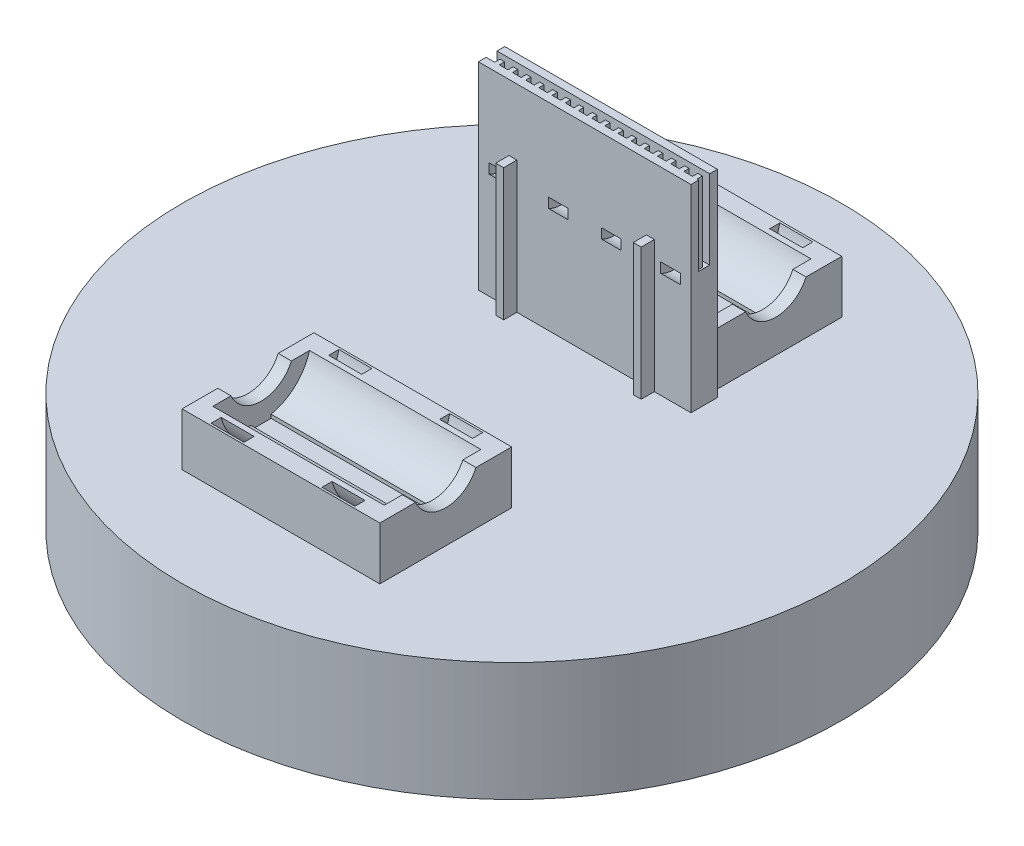
from build123d import *

# Parameters (mm, degrees)
AUFSATZ_LINEAR_AUSTRAGEN1_DEPTH      = 1.6
AUFSATZ_LINEAR_AUSTRAGEN1_DEPTH_BACK = 16.4
SKIZZE1_R                            = 50
SKIZZE2_W                            = 30
SKIZZE2_H                            = 20
AUFSATZ_LINEAR_AUSTRAGEN2_DEPTH      = 8
SKIZZE4_R                            = 7.6
SCHNITT_LINEAR_AUSTRAGEN1_DEPTH      = 85.315834812
AUFSATZ_LINEAR_AUSTRAGEN3_DEPTH      = 2
SKIZZE7_W                            = 3
SKIZZE7_H                            = 0.8
SCHNITT_LINEAR_AUSTRAGEN2_DEPTH      = 13
SKIZZE6_W                            = 5
SKIZZE6_H                            = 1.5
SPIEGELN3_COPY_1_DEPTH               = 2
SPIEGELN3_COPY_2_SKETCH_W            = 5
SPIEGELN3_COPY_2_SKETCH_H            = 1.5
SKIZZE9_W                            = 32.252572888
SKIZZE9_H                            = 4
AUFSATZ_LINEAR_AUSTRAGEN4_DEPTH      = 30
SCHNITT_LINEAR_AUSTRAGEN3_DEPTH      = 12
SKIZZE11_W                           = 1.2
SKIZZE11_H                           = 2
AUFSATZ_LINEAR_AUSTRAGEN5_DEPTH      = 20
SKIZZE13_W                           = 3
SKIZZE13_H                           = 1.2
SCHNITT_ROTATION3_ANGLE              = 180
LINEARES_MUSTER1_COUNT               = 2
LINEARES_MUSTER1_PITCH               = 9
SPIEGELN4_COPY_1_SKETCH_W            = 3
SPIEGELN4_COPY_1_SKETCH_H            = 1.2
SPIEGELN4_COPY_1_ANGLE               = 180


with BuildPart() as part:
    # Skizze1 → Aufsatz-Linear austragen1 (new, two sides: drawn at the far end of the back side and taken through both)
    with BuildSketch(Plane(origin=(0, 10, 0), x_dir=(1, 0, 0), z_dir=(0, 1, 0)).offset(-AUFSATZ_LINEAR_AUSTRAGEN1_DEPTH_BACK)):
        with Locations(Location((0, 0, 0), (0, 0, 270))):
            Circle(SKIZZE1_R)
    extrude(amount=AUFSATZ_LINEAR_AUSTRAGEN1_DEPTH + AUFSATZ_LINEAR_AUSTRAGEN1_DEPTH_BACK)

    # Skizze2 → Aufsatz-Linear austragen2 (add)
    with BuildSketch(Plane(origin=(0, 11.6, 0), x_dir=(1, 0, 0), z_dir=(0, 1, 0))):
        with Locations((0, 25.04)):
            Rectangle(SKIZZE2_W, SKIZZE2_H)
    aufsatz_linear_austragen2 = extrude(amount=AUFSATZ_LINEAR_AUSTRAGEN2_DEPTH)

    # Skizze4 → Schnitt-Linear austragen1 (cut, through all)
    with BuildSketch(Plane.ZY.offset(15)):
        with Locations((-25.04, 21.6)):
            Circle(SKIZZE4_R)
    schnitt_linear_austragen1 = extrude(amount=-SCHNITT_LINEAR_AUSTRAGEN1_DEPTH, mode=Mode.SUBTRACT)

    # Skizze5 → Aufsatz-Linear austragen3 (add)
    with BuildSketch(Plane.ZY.offset(15)):
        with BuildLine():
            Line((-29.622575695, 19.6), (-32.372121112, 19.6))
            ThreePointArc((-32.372121112, 19.6), (-25.04, 14), (-17.707878888, 19.6))
            Line((-17.707878888, 19.6), (-20.457424305, 19.6))
            ThreePointArc((-20.457424305, 19.6), (-25.04, 16.6), (-29.622575695, 19.6))
        make_face()
    aufsatz_linear_austragen3 = extrude(amount=-AUFSATZ_LINEAR_AUSTRAGEN3_DEPTH)

    # Spiegeln1: Aufsatz-Linear austragen3 across plane
    add(aufsatz_linear_austragen3.mirror(Plane(origin=(0, 0, 0), x_dir=(0, 0, 1), z_dir=(1, 0, 0))))

    # Skizze7 → Schnitt-Linear austragen2 (cut, symmetric)
    with BuildSketch(Plane(origin=(0, 0, 0), x_dir=(0, 0, -1), z_dir=(1, 0, 0))):
        with Locations((25.04, 14)):
            Rectangle(SKIZZE7_W, SKIZZE7_H)
    schnitt_linear_austragen2 = extrude(amount=SCHNITT_LINEAR_AUSTRAGEN2_DEPTH, both=True, mode=Mode.SUBTRACT)

    # Skizze6 → Schnitt-Rotation2 (revolve, cut)
    with BuildSketch(Plane.XY.offset(-25.04)):
        with Locations((-8.412172741, 30.75)):
            Rectangle(SKIZZE6_W, SKIZZE6_H)
    schnitt_rotation2 = revolve(axis=Axis((-15, 21.6, -25.04), (1, 0, 0)), mode=Mode.SUBTRACT)

    # Spiegeln2: Schnitt-Rotation2 across plane
    add(schnitt_rotation2.mirror(Plane(origin=(0, 0, 0), x_dir=(0, 0, 1), z_dir=(1, 0, 0))), mode=Mode.SUBTRACT)

    # Spiegeln3: Aufsatz-Linear austragen2, Schnitt-Linear austragen1, Aufsatz-Linear austragen3, Schnitt-Linear austragen2, Schnitt-Rotation2 across plane
    add(aufsatz_linear_austragen2.mirror(Plane.XY))
    add(schnitt_linear_austragen1.mirror(Plane.XY), mode=Mode.SUBTRACT)
    add(aufsatz_linear_austragen3.mirror(Plane.XY))
    add(schnitt_linear_austragen2.mirror(Plane.XY), mode=Mode.SUBTRACT)
    add(schnitt_rotation2.mirror(Plane.XY), mode=Mode.SUBTRACT)

    # Spiegeln3 copy 1 sketch → Spiegeln3 copy 1 (add)
    with BuildSketch(Plane(origin=(15, 0, 0), x_dir=(0, 0, -1), z_dir=(1, 0, 0))):
        with BuildLine():
            Line((-29.622575695, 19.6), (-32.372121112, 19.6))
            ThreePointArc((-32.372121112, 19.6), (-25.04, 14), (-17.707878888, 19.6))
            Line((-17.707878888, 19.6), (-20.457424305, 19.6))
            ThreePointArc((-20.457424305, 19.6), (-25.04, 16.6), (-29.622575695, 19.6))
        make_face()
    extrude(amount=-SPIEGELN3_COPY_1_DEPTH)

    # Spiegeln3 copy 2 sketch → Spiegeln3 copy 2 (revolve, cut)
    with BuildSketch(Plane(origin=(0, 0, 25.04), x_dir=(-1, 0, 0), z_dir=(0, 0, -1))):
        with Locations((-8.412172741, 30.75)):
            Rectangle(SPIEGELN3_COPY_2_SKETCH_W, SPIEGELN3_COPY_2_SKETCH_H)
    revolve(axis=Axis((15, 21.6, 25.04), (-1, 0, 0)), mode=Mode.SUBTRACT)

    # Skizze9 → Aufsatz-Linear austragen4 (add)
    with BuildSketch(Plane(origin=(0, 11.6, 0), x_dir=(1, 0, 0), z_dir=(0, 1, 0))):
        with Locations((0, 13.04)):
            Rectangle(SKIZZE9_W, SKIZZE9_H)
    extrude(amount=AUFSATZ_LINEAR_AUSTRAGEN4_DEPTH)

    # Skizze10 → Schnitt-Linear austragen3 (cut)
    with BuildSketch(Plane(origin=(0, 41.6, 0), x_dir=(1, 0, 0), z_dir=(0, 1, 0))):
        Polygon((-16.126286444, 12.215), (-14.826286444, 12.215), (-14.826286444, 13.015), (-14.126286444, 13.015), (-14.126286444, 12.215), (-12.826286444, 12.215), (-12.826286444, 13.015), (-12.126286444, 13.015), (-12.126286444, 12.215), (-10.826286444, 12.215), (-10.826286444, 13.015), (-10.126286444, 13.015), (-10.126286444, 12.215), (-8.826286444, 12.215), (-8.826286444, 13.015), (-8.126286444, 13.015), (-8.126286444, 12.215), (-6.826286444, 12.215), (-6.826286444, 13.015), (-6.126286444, 13.015), (-6.126286444, 12.215), (-4.826286444, 12.215), (-4.826286444, 13.015), (-4.126286444, 13.015), (-4.126286444, 12.215), (-2.826286444, 12.215), (-2.826286444, 13.015), (-2.126286444, 13.015), (-2.126286444, 12.215), (-0.826286444, 12.215), (-0.826286444, 13.015), (-0.126286444, 13.015), (-0.126286444, 12.215), (1.173713556, 12.215), (1.173713556, 13.015), (1.873713556, 13.015), (1.873713556, 12.215), (3.173713556, 12.215), (3.173713556, 13.015), (3.873713556, 13.015), (3.873713556, 12.215), (5.173713556, 12.215), (5.173713556, 13.015), (5.873713556, 13.015), (5.873713556, 12.215), (7.173713556, 12.215), (7.173713556, 13.015), (7.873713556, 13.015), (7.873713556, 12.215), (9.173713556, 12.215), (9.173713556, 13.015), (9.873713556, 13.015), (9.873713556, 12.215), (11.173713556, 12.215), (11.173713556, 13.015), (11.873713556, 13.015), (11.873713556, 12.215), (13.173713556, 12.215), (13.173713556, 13.015), (13.873713556, 13.015), (13.873713556, 12.215), (15.173713556, 12.215), (15.173713556, 13.015), (15.873713556, 13.015), (15.873713556, 12.215), (17.173713556, 12.215), (17.173713556, 13.865), (-16.126286444, 13.865), (-16.126286444, 13.065), align=None)
    extrude(amount=-SCHNITT_LINEAR_AUSTRAGEN3_DEPTH, mode=Mode.SUBTRACT)

    # Skizze11 → Aufsatz-Linear austragen5 (add)
    with BuildSketch(Plane(origin=(0, 11.6, 0), x_dir=(1, 0, 0), z_dir=(0, 1, 0))):
        with Locations((-10.891559468, 10.04)):
            Rectangle(SKIZZE11_W, SKIZZE11_H)
        with Locations((9.966595777, 10.04)):
            Rectangle(SKIZZE11_W, SKIZZE11_H)
    extrude(amount=AUFSATZ_LINEAR_AUSTRAGEN5_DEPTH)

    # Skizze13 → Schnitt-Rotation3 (revolve, cut)
    with BuildSketch(Plane(origin=(0, 31.1, 0), x_dir=(1, 0, 0), z_dir=(0, 1, 0))):
        with Locations((-13.026286444, 16.44)):
            Rectangle(SKIZZE13_W, SKIZZE13_H)
    schnitt_rotation3 = revolve(axis=Axis((-16.126286444, 31.1, -13.04), (-1, 0, 0)), revolution_arc=SCHNITT_ROTATION3_ANGLE, mode=Mode.SUBTRACT)

    # Lineares Muster1: Schnitt-Rotation3 ×2
    with Locations(*[(i * LINEARES_MUSTER1_PITCH, 0, 0) for i in range(1, LINEARES_MUSTER1_COUNT)]):
        add(schnitt_rotation3, mode=Mode.SUBTRACT)

    # Spiegeln4: Schnitt-Rotation3 across plane
    add(schnitt_rotation3.mirror(Plane(origin=(0, 0, 0), x_dir=(0, 0, 1), z_dir=(1, 0, 0))), mode=Mode.SUBTRACT)

    # Spiegeln4 copy 1 sketch → Spiegeln4 copy 1 (revolve, cut)
    with BuildSketch(Plane(origin=(-9, 31.1, 0), x_dir=(-1, 0, 0), z_dir=(0, 1, 0))):
        with Locations((-13.026286444, -16.44)):
            Rectangle(SPIEGELN4_COPY_1_SKETCH_W, SPIEGELN4_COPY_1_SKETCH_H)
    revolve(axis=Axis((7.126286444, 31.1, -13.04), (-1, 0, 0)), revolution_arc=SPIEGELN4_COPY_1_ANGLE, mode=Mode.SUBTRACT)


solid = part.part
